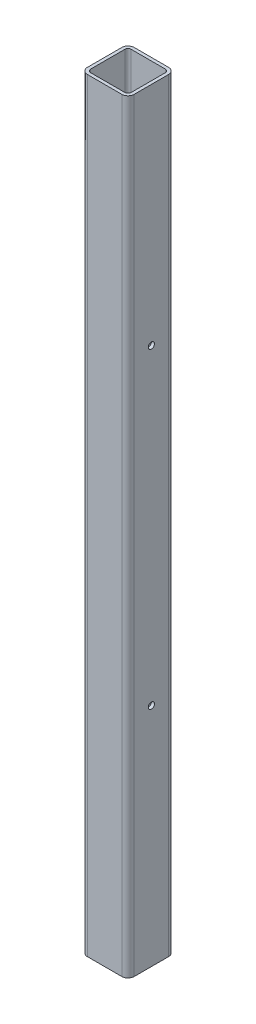
from build123d import *

# Parameters (mm, degrees)
EXTRUDE_1_DEPTH     = 245
CUT_EXTRUDE_1_REACH = 247.917
SKETCH_2_R          = 2
CUT_EXTRUDE_2_REACH = 247.917
SKETCH_3_R          = 6
SKETCH_4_W          = 15
SKETCH_4_H          = 30
CUT_EXTRUDE_3_DEPTH = 2


with BuildPart() as part:
    # 草图1 → 凸台-拉伸1 (new, symmetric)
    with BuildSketch(Plane(origin=(0, 0, 0), x_dir=(1, 0, 0), z_dir=(0, 1, 0))):
        with BuildLine():
            Line((-11, -15), (11, -15))
            ThreePointArc((11, -15), (13.828427125, -13.828427125), (15, -11))
            Line((15, -11), (15, 11))
            ThreePointArc((15, 11), (13.828427125, 13.828427125), (11, 15))
            Line((11, 15), (-11, 15))
            ThreePointArc((-11, 15), (-13.828427125, 13.828427125), (-15, 11))
            Line((-15, 11), (-15, -11))
            ThreePointArc((-15, -11), (-13.828427125, -13.828427125), (-11, -15))
        make_face()
        with BuildLine():
            Line((-11, -13), (11, -13))
            ThreePointArc((11, -13), (12.414213562, -12.414213562), (13, -11))
            Line((13, -11), (13, 11))
            ThreePointArc((13, 11), (12.414213562, 12.414213562), (11, 13))
            Line((11, 13), (-11, 13))
            ThreePointArc((-11, 13), (-12.414213562, 12.414213562), (-13, 11))
            Line((-13, 11), (-13, -11))
            ThreePointArc((-13, -11), (-12.414213562, -12.414213562), (-11, -13))
        make_face(mode=Mode.SUBTRACT)
    extrude(amount=EXTRUDE_1_DEPTH, both=True)

    # 草图2 → 切除-拉伸1 (cut, up to next)
    with BuildSketch(Plane(origin=(0, 0, 0), x_dir=(0, 0, -1), z_dir=(1, 0, 0)), mode=Mode.PRIVATE) as cut_extrude_1_sk1:
        with Locations(Location((0, -100, 0), (0, 0, 180))):
            Circle(SKETCH_2_R)
    cut_extrude_1_tool1 = extrude(cut_extrude_1_sk1.sketch, amount=CUT_EXTRUDE_1_REACH, mode=Mode.PRIVATE) & part.part
    # 草图2 → 切除-拉伸1 (cut, up to next)
    with BuildSketch(Plane(origin=(0, 0, 0), x_dir=(0, 0, -1), z_dir=(1, 0, 0)), mode=Mode.PRIVATE) as cut_extrude_1_sk2:
        with Locations(Location((0, 100, 0), (0, 0, 180))):
            Circle(SKETCH_2_R)
    cut_extrude_1_tool2 = extrude(cut_extrude_1_sk2.sketch, amount=CUT_EXTRUDE_1_REACH, mode=Mode.PRIVATE) & part.part
    add(cut_extrude_1_tool1.solids().sort_by_distance((0, -100, 0))[0], mode=Mode.SUBTRACT)
    add(cut_extrude_1_tool2.solids().sort_by_distance((0, 100, 0))[0], mode=Mode.SUBTRACT)

    # 草图3 → 切除-拉伸2 (cut, up to next)
    with BuildSketch(Plane(origin=(0, 0, 0), x_dir=(0, 0, -1), z_dir=(1, 0, 0)), mode=Mode.PRIVATE) as cut_extrude_2_sk1:
        with Locations((0, -100)):
            Circle(SKETCH_3_R)
    cut_extrude_2_tool1 = extrude(cut_extrude_2_sk1.sketch, amount=-CUT_EXTRUDE_2_REACH, mode=Mode.PRIVATE) & part.part
    # 草图3 → 切除-拉伸2 (cut, up to next)
    with BuildSketch(Plane(origin=(0, 0, 0), x_dir=(0, 0, -1), z_dir=(1, 0, 0)), mode=Mode.PRIVATE) as cut_extrude_2_sk2:
        with Locations((0, 100)):
            Circle(SKETCH_3_R)
    cut_extrude_2_tool2 = extrude(cut_extrude_2_sk2.sketch, amount=-CUT_EXTRUDE_2_REACH, mode=Mode.PRIVATE) & part.part
    add(cut_extrude_2_tool1.solids().sort_by_distance((0, -100, 0))[0], mode=Mode.SUBTRACT)
    add(cut_extrude_2_tool2.solids().sort_by_distance((0, 100, 0))[0], mode=Mode.SUBTRACT)

    # 草图4 → 切除-拉伸3 (cut)
    with BuildSketch(Plane.XY.offset(-15)):
        with Locations((7.5, -100)):
            Rectangle(SKETCH_4_W, SKETCH_4_H)
        with Locations((7.5, 100)):
            Rectangle(SKETCH_4_W, SKETCH_4_H)
    extrude(amount=CUT_EXTRUDE_3_DEPTH, mode=Mode.SUBTRACT)


solid = part.part
